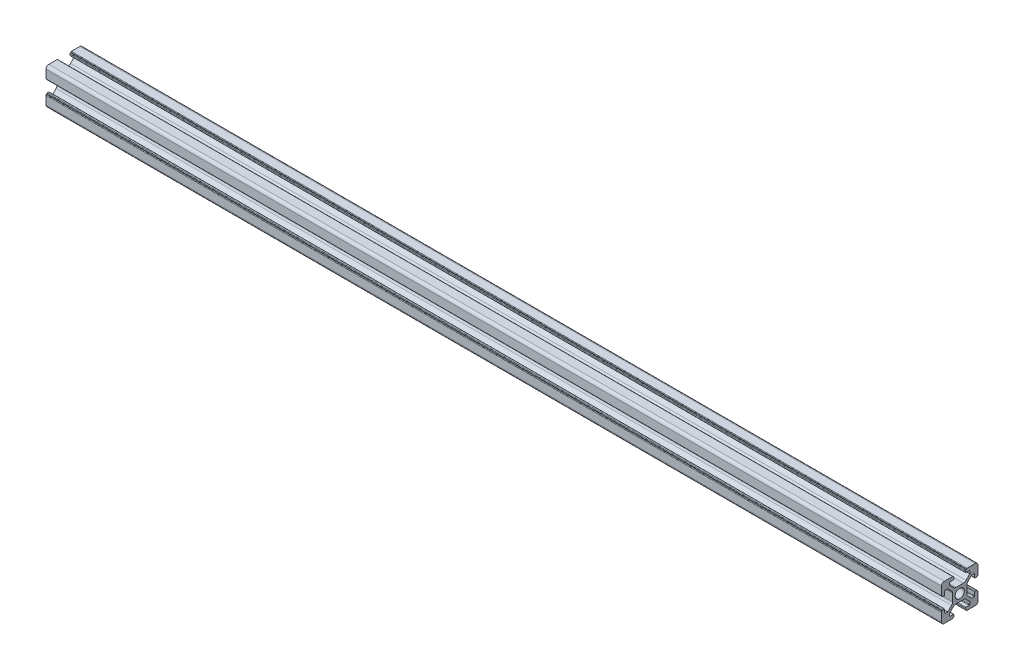
from build123d import *

# Parameters (mm, degrees)
SKETCH_11_R         = 2.5
MEMBER_2020_1_DEPTH = 490


with BuildPart() as part:
    # 草图11 → Member 2020_1 (new body)
    with BuildSketch(Plane(origin=(-48.295687885, 66.909650924, 0), x_dir=(0, 1, 0), z_dir=(1, 0, 0))):
        with BuildLine():
            Line((3.9, 0), (3.9, -2.010912703))
            ThreePointArc((3.9, -2.010912703), (4.052240935, -2.776279568), (4.485786438, -3.425126266))
            Line((4.485786438, -3.425126266), (6.560660172, -5.5))
            Line((6.560660172, -5.5), (7.9, -5.5))
            ThreePointArc((7.9, -5.5), (8.112132034, -5.412132034), (8.2, -5.2))
            Line((8.2, -5.2), (8.2, -3.4))
            ThreePointArc((8.2, -3.4), (8.287867966, -3.187867966), (8.5, -3.1))
            Line((8.5, -3.1), (9.2, -3.1))
            ThreePointArc((9.2, -3.1), (9.412132034, -3.187867966), (9.5, -3.4))
            Line((9.5, -3.4), (9.5, -3.6))
            Line((9.5, -3.6), (9.7, -3.6))
            ThreePointArc((9.7, -3.6), (9.912132034, -3.687867966), (10, -3.9))
            Line((10, -3.9), (10, -8.5))
            ThreePointArc((10, -8.5), (9.560660172, -9.560660172), (8.5, -10))
            Line((8.5, -10), (3.9, -10))
            ThreePointArc((3.9, -10), (3.687867966, -9.912132034), (3.6, -9.7))
            ThreePointArc((3.6, -9.7), (3.541421356, -9.558578644), (3.4, -9.5))
            ThreePointArc((3.4, -9.5), (3.187867966, -9.412132034), (3.1, -9.2))
            Line((3.1, -9.2), (3.1, -8.5))
            ThreePointArc((3.1, -8.5), (3.187867966, -8.287867966), (3.4, -8.2))
            Line((3.4, -8.2), (5.2, -8.2))
            ThreePointArc((5.2, -8.2), (5.412132034, -8.112132034), (5.5, -7.9))
            Line((5.5, -7.9), (5.5, -6.68492424))
            ThreePointArc((5.5, -6.68492424), (5.47716386, -6.570119211), (5.412132034, -6.472792206))
            Line((5.412132034, -6.472792206), (3.425126266, -4.485786438))
            ThreePointArc((3.425126266, -4.485786438), (2.776279568, -4.052240935), (2.010912703, -3.9))
            Line((2.010912703, -3.9), (0, -3.9))
            Line((0, -3.9), (-2.010912703, -3.9))
            ThreePointArc((-2.010912703, -3.9), (-2.776279568, -4.052240935), (-3.425126266, -4.485786438))
            Line((-3.425126266, -4.485786438), (-5.412132034, -6.472792206))
            ThreePointArc((-5.412132034, -6.472792206), (-5.47716386, -6.570119211), (-5.5, -6.68492424))
            Line((-5.5, -6.68492424), (-5.5, -7.9))
            ThreePointArc((-5.5, -7.9), (-5.412132034, -8.112132034), (-5.2, -8.2))
            Line((-5.2, -8.2), (-3.4, -8.2))
            ThreePointArc((-3.4, -8.2), (-3.187867966, -8.287867966), (-3.1, -8.5))
            Line((-3.1, -8.5), (-3.1, -9.2))
            ThreePointArc((-3.1, -9.2), (-3.187867966, -9.412132034), (-3.4, -9.5))
            ThreePointArc((-3.4, -9.5), (-3.541421356, -9.558578644), (-3.6, -9.7))
            ThreePointArc((-3.6, -9.7), (-3.687867966, -9.912132034), (-3.9, -10))
            Line((-3.9, -10), (-8.5, -10))
            ThreePointArc((-8.5, -10), (-9.560660172, -9.560660172), (-10, -8.5))
            Line((-10, -8.5), (-10, -3.9))
            ThreePointArc((-10, -3.9), (-9.912132034, -3.687867966), (-9.7, -3.6))
            Line((-9.7, -3.6), (-9.5, -3.6))
            Line((-9.5, -3.6), (-9.5, -3.4))
            ThreePointArc((-9.5, -3.4), (-9.412132034, -3.187867966), (-9.2, -3.1))
            Line((-9.2, -3.1), (-8.5, -3.1))
            ThreePointArc((-8.5, -3.1), (-8.287867965, -3.187867966), (-8.2, -3.4))
            Line((-8.2, -3.4), (-8.2, -5.2))
            ThreePointArc((-8.2, -5.2), (-8.112132034, -5.412132034), (-7.9, -5.5))
            Line((-7.9, -5.5), (-6.68492424, -5.5))
            ThreePointArc((-6.68492424, -5.5), (-6.570119211, -5.47716386), (-6.472792206, -5.412132034))
            Line((-6.472792206, -5.412132034), (-4.485786438, -3.425126266))
            ThreePointArc((-4.485786438, -3.425126266), (-4.052240935, -2.776279568), (-3.9, -2.010912703))
            Line((-3.9, -2.010912703), (-3.9, 0))
            Line((-3.9, 0), (-3.9, 2.010912703))
            ThreePointArc((-3.9, 2.010912703), (-4.052240935, 2.776279568), (-4.485786438, 3.425126266))
            Line((-4.485786438, 3.425126266), (-6.472792206, 5.412132034))
            ThreePointArc((-6.472792206, 5.412132034), (-6.570119211, 5.47716386), (-6.68492424, 5.5))
            Line((-6.68492424, 5.5), (-7.9, 5.5))
            ThreePointArc((-7.9, 5.5), (-8.112132034, 5.412132034), (-8.2, 5.2))
            Line((-8.2, 5.2), (-8.2, 3.4))
            ThreePointArc((-8.2, 3.4), (-8.287867965, 3.187867966), (-8.5, 3.1))
            Line((-8.5, 3.1), (-9.2, 3.1))
            ThreePointArc((-9.2, 3.1), (-9.412132034, 3.187867966), (-9.5, 3.4))
            Line((-9.5, 3.4), (-9.5, 3.6))
            Line((-9.5, 3.6), (-9.7, 3.6))
            ThreePointArc((-9.7, 3.6), (-9.912132034, 3.687867966), (-10, 3.9))
            Line((-10, 3.9), (-10, 8.5))
            ThreePointArc((-10, 8.5), (-9.560660172, 9.560660172), (-8.5, 10))
            Line((-8.5, 10), (-3.9, 10))
            ThreePointArc((-3.9, 10), (-3.687867966, 9.912132034), (-3.6, 9.7))
            Line((-3.6, 9.7), (-3.6, 9.5))
            Line((-3.6, 9.5), (-3.4, 9.5))
            ThreePointArc((-3.4, 9.5), (-3.187867966, 9.412132034), (-3.1, 9.2))
            Line((-3.1, 9.2), (-3.1, 8.5))
            ThreePointArc((-3.1, 8.5), (-3.187867966, 8.287867966), (-3.4, 8.2))
            Line((-3.4, 8.2), (-5.2, 8.2))
            ThreePointArc((-5.2, 8.2), (-5.412132034, 8.112132034), (-5.5, 7.9))
            Line((-5.5, 7.9), (-5.5, 6.68492424))
            ThreePointArc((-5.5, 6.68492424), (-5.47716386, 6.570119211), (-5.412132034, 6.472792206))
            Line((-5.412132034, 6.472792206), (-3.425126266, 4.485786438))
            ThreePointArc((-3.425126266, 4.485786438), (-2.776279568, 4.052240935), (-2.010912703, 3.9))
            Line((-2.010912703, 3.9), (0, 3.9))
            Line((0, 3.9), (2.010912703, 3.9))
            ThreePointArc((2.010912703, 3.9), (2.776279568, 4.052240935), (3.425126266, 4.485786438))
            Line((3.425126266, 4.485786438), (5.412132034, 6.472792206))
            ThreePointArc((5.412132034, 6.472792206), (5.47716386, 6.570119211), (5.5, 6.68492424))
            Line((5.5, 6.68492424), (5.5, 7.9))
            ThreePointArc((5.5, 7.9), (5.412132034, 8.112132034), (5.2, 8.2))
            Line((5.2, 8.2), (3.4, 8.2))
            ThreePointArc((3.4, 8.2), (3.187867966, 8.287867966), (3.1, 8.5))
            Line((3.1, 8.5), (3.1, 9.2))
            ThreePointArc((3.1, 9.2), (3.187867966, 9.412132034), (3.4, 9.5))
            Line((3.4, 9.5), (3.6, 9.5))
            Line((3.6, 9.5), (3.6, 9.7))
            ThreePointArc((3.6, 9.7), (3.687867966, 9.912132034), (3.9, 10))
            Line((3.9, 10), (8.5, 10))
            ThreePointArc((8.5, 10), (9.560660172, 9.560660172), (10, 8.5))
            Line((10, 8.5), (10, 3.9))
            ThreePointArc((10, 3.9), (9.912132034, 3.687867966), (9.7, 3.6))
            Line((9.7, 3.6), (9.5, 3.6))
            Line((9.5, 3.6), (9.5, 3.4))
            ThreePointArc((9.5, 3.4), (9.412132034, 3.187867966), (9.2, 3.1))
            Line((9.2, 3.1), (8.5, 3.1))
            ThreePointArc((8.5, 3.1), (8.287867966, 3.187867966), (8.2, 3.4))
            Line((8.2, 3.4), (8.2, 5.2))
            ThreePointArc((8.2, 5.2), (8.112132034, 5.412132034), (7.9, 5.5))
            Line((7.9, 5.5), (6.68492424, 5.5))
            ThreePointArc((6.68492424, 5.5), (6.570119211, 5.47716386), (6.472792206, 5.412132034))
            Line((6.472792206, 5.412132034), (4.485786438, 3.425126266))
            ThreePointArc((4.485786438, 3.425126266), (4.052240935, 2.776279568), (3.9, 2.010912703))
            Line((3.9, 2.010912703), (3.9, 0))
        make_face()
        Circle(SKETCH_11_R, mode=Mode.SUBTRACT)
    extrude(amount=MEMBER_2020_1_DEPTH)


solid = part.part
